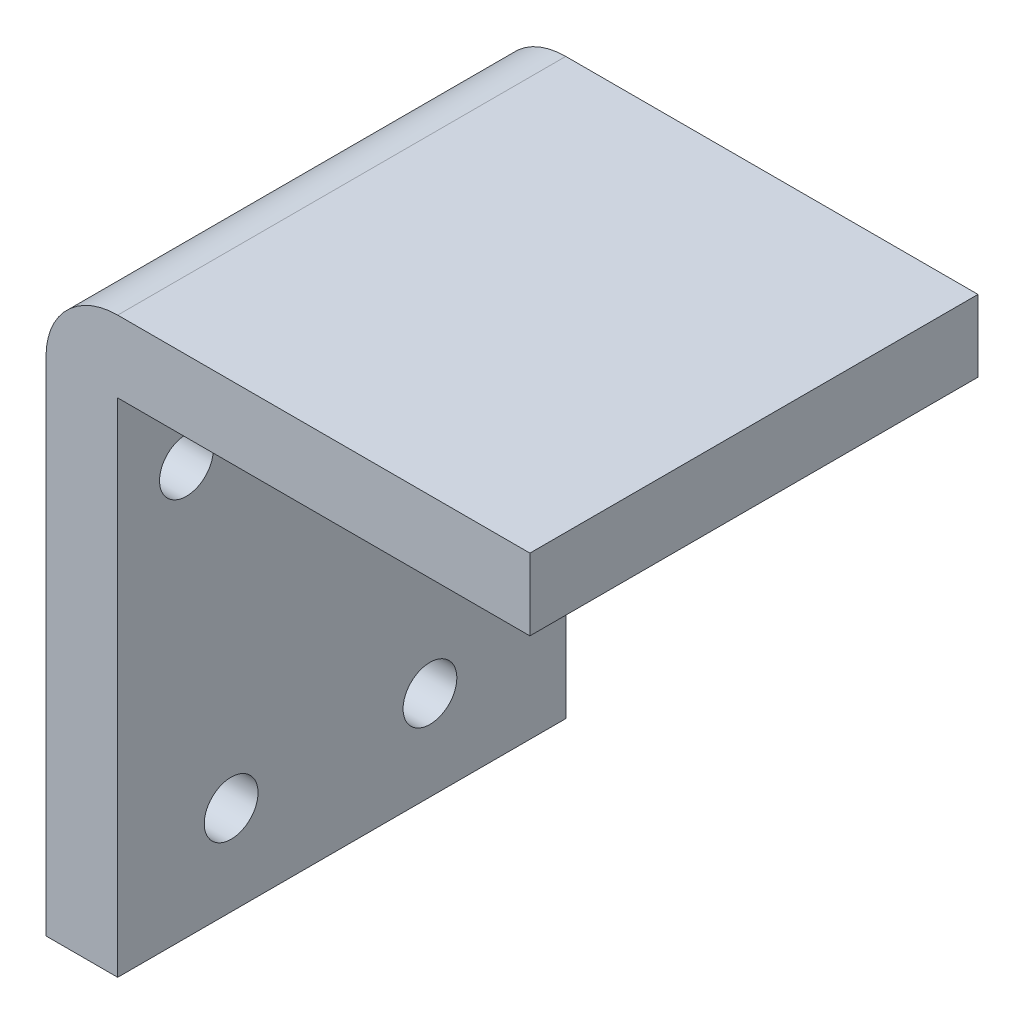
from build123d import *

# Parameters (mm, degrees)
SALIENTE_EXTRUIR1_DEPTH = 100
CROQUIS2_R              = 6
CORTAR_EXTRUIR1_DEPTH   = 100


with BuildPart() as part:
    # Croquis1 → Saliente-Extruir1 (new body)
    with BuildSketch(Plane.XY):
        with BuildLine():
            Line((8, -8), (8, -120))
            Line((8, -120), (-8, -120))
            Line((-8, -120), (-8, -8))
            ThreePointArc((-8, -8), (-3.313708499, 3.313708499), (8, 8))
            Line((8, 8), (100, 8))
            Line((100, 8), (100, -8))
            Line((100, -8), (8, -8))
        make_face()
    extrude(amount=SALIENTE_EXTRUIR1_DEPTH)

    # Croquis2 → Cortar-Extruir1 (cut)
    with BuildSketch(Plane(origin=(8, 0, 0), x_dir=(0, 0, -1), z_dir=(1, 0, 0))):
        with Locations((-84.666164139, -28.683062658)):
            Circle(CROQUIS2_R)
        with Locations((-48.336024121, -28.683062658)):
            Circle(CROQUIS2_R)
        with Locations((-15.333835861, -28.683062658)):
            Circle(CROQUIS2_R)
        with Locations((-74.682308867, -99.956696128)):
            Circle(CROQUIS2_R)
        with Locations((-30.309618769, -99.956696128)):
            Circle(CROQUIS2_R)
    extrude(amount=-CORTAR_EXTRUIR1_DEPTH, mode=Mode.SUBTRACT)


solid = part.part
